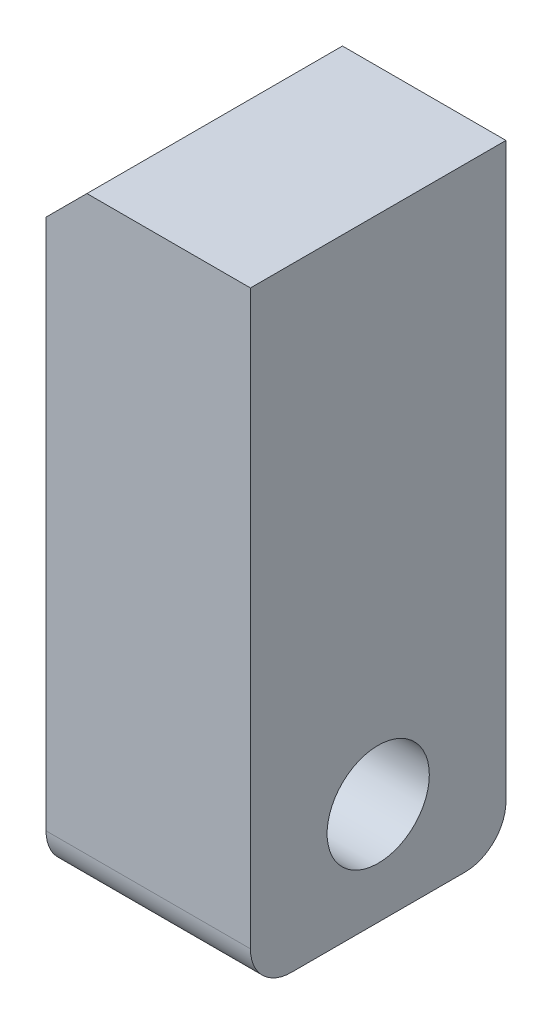
from build123d import *

# Parameters (mm, degrees)
SKETCH_1_W               = 12.5
SKETCH_1_H               = 30
EXTRUDE_1_DEPTH          = 10
CUT_EXTRUDE_1_DEPTH      = 20.080421903
CUT_EXTRUDE_1_DEPTH_BACK = 20.080421903
SKETCH_2_R               = 2.5
FILLET_1_R               = 2
CHAMFER_1_SIZE           = 2


with BuildPart() as part:
    # 草图1 → 凸台-拉伸1 (new body)
    with BuildSketch(Plane(origin=(0, 0, 0), x_dir=(0, 0, -1), z_dir=(1, 0, 0))):
        Rectangle(SKETCH_1_W, SKETCH_1_H)
    extrude(amount=EXTRUDE_1_DEPTH)

    # 草图2 → 切除-拉伸1 (cut, two sides: drawn at the far end of the back side and taken through both)
    with BuildSketch(Plane(origin=(10, 0, 0), x_dir=(0, 0, -1), z_dir=(1, 0, 0)).offset(-CUT_EXTRUDE_1_DEPTH_BACK)):
        with Locations((0, -10)):
            Circle(SKETCH_2_R)
    extrude(amount=CUT_EXTRUDE_1_DEPTH + CUT_EXTRUDE_1_DEPTH_BACK, mode=Mode.SUBTRACT)

    # 圆角1
    fillet_1_edges = [part.edges().sort_by_distance(p)[0] for p in [
        (5, -15, -6.25),
        (5, -15, 6.25),
    ]]
    fillet(fillet_1_edges, radius=FILLET_1_R)

    # 倒角1
    chamfer_1_edges = [part.edges().sort_by_distance(p)[0] for p in [
        (0, 15, 0),
    ]]
    chamfer(chamfer_1_edges, length=CHAMFER_1_SIZE)


solid = part.part
